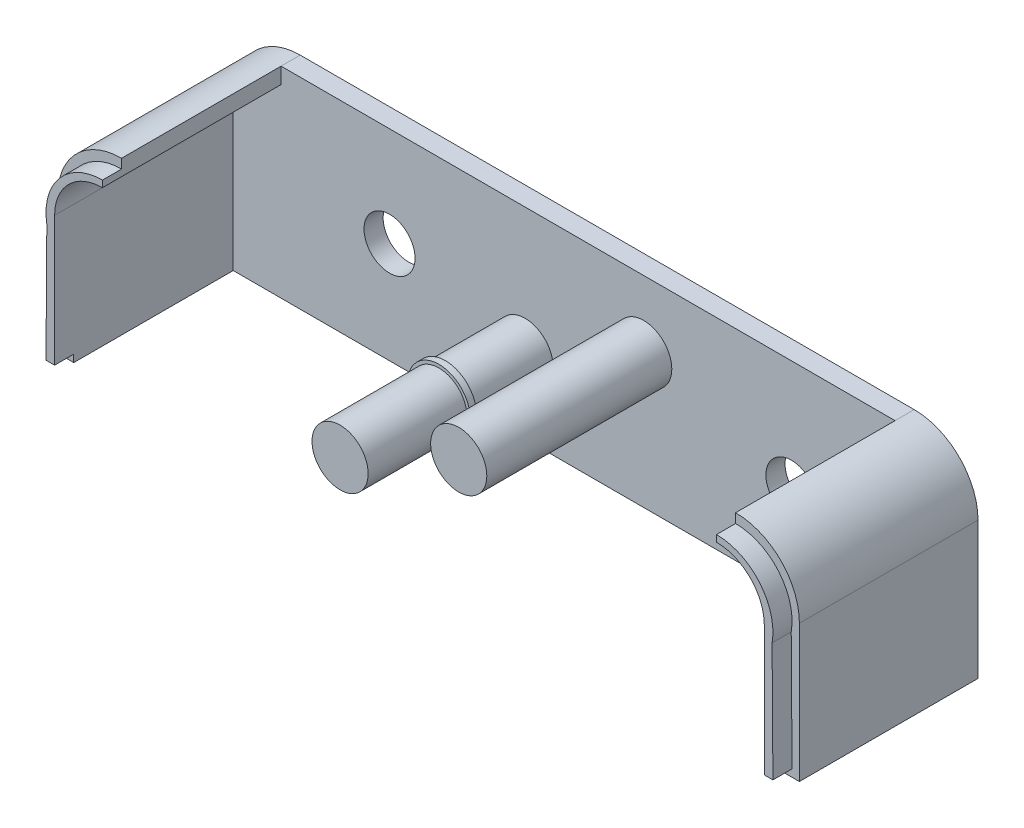
from build123d import *

# Parameters (mm, degrees)
SKETCH1_R           = 4
BOSS_EXTRUDE2_DEPTH = 3
SKETCH2_R           = 4.4
BOSS_EXTRUDE3_DEPTH = 25
CUT_EXTRUDE3_START  = -1
SKETCH10_R          = 4.4
CUT_EXTRUDE3_DEPTH  = 1
BOSS_EXTRUDE5_DEPTH = 3
SKETCH12_R          = 4.4
BOSS_EXTRUDE6_DEPTH = 5
SKETCH14_R          = 4.9
BOSS_EXTRUDE7_DEPTH = 1


with BuildPart() as part:
    # Sketch1 → Boss-Extrude2 (new body)
    with BuildSketch(Plane.XY):
        with BuildLine():
            Line((-48.125, 15.75), (48.125, 15.75))
            ThreePointArc((48.125, 15.75), (55.196067812, 12.821067812), (58.125, 5.75))
            Line((58.125, 5.75), (58.125, -15.75))
            Line((58.125, -15.75), (-58.125, -15.75))
            Line((-58.125, -15.75), (-58.125, 5.75))
            ThreePointArc((-58.125, 5.75), (-55.196067812, 12.821067812), (-48.125, 15.75))
        make_face()
        with Locations((31.875, -1.75)):
            Circle(SKETCH1_R, mode=Mode.SUBTRACT)
        with Locations((-31.125, 0.15)):
            Circle(SKETCH1_R, mode=Mode.SUBTRACT)
    extrude(amount=BOSS_EXTRUDE2_DEPTH)

    # Sketch2 → Boss-Extrude3 (add)
    with BuildSketch(Plane.XY.offset(3)):
        with Locations((8.725, 5.25)):
            Circle(SKETCH2_R)
        with Locations((-9.875, -3.75)):
            Circle(SKETCH2_R)
        with BuildLine():
            Line((55.625, 5.75), (55.625, -15.75))
            Line((55.625, -15.75), (58.125, -15.75))
            Line((58.125, -15.75), (58.125, 5.25))
            Line((58.125, 5.25), (58.125, 5.75))
            ThreePointArc((58.125, 5.75), (55.196067812, 12.821067812), (48.125, 15.75))
            Line((48.125, 15.75), (48.125, 13.25))
            ThreePointArc((48.125, 13.25), (53.428300859, 11.053300859), (55.625, 5.75))
        make_face()
        with BuildLine():
            Line((-58.125, -15.75), (-55.625, -15.75))
            Line((-55.625, -15.75), (-55.625, 5.75))
            ThreePointArc((-55.625, 5.75), (-53.428300859, 11.053300859), (-48.125, 13.25))
            Line((-48.125, 13.25), (-48.125, 15.75))
            ThreePointArc((-48.125, 15.75), (-55.196067812, 12.821067812), (-58.125, 5.75))
            Line((-58.125, 5.75), (-58.125, 5.25))
            Line((-58.125, 5.25), (-58.125, -15.75))
        make_face()
    extrude(amount=BOSS_EXTRUDE3_DEPTH)

    # Sketch10 → Cut-Extrude3 (cut)
    with BuildSketch(Plane.XY.offset(28).offset(CUT_EXTRUDE3_START)):
        with Locations((8.725, 5.25)):
            Circle(SKETCH10_R)
        with Locations((-9.875, -3.75)):
            Circle(SKETCH10_R)
    extrude(amount=CUT_EXTRUDE3_DEPTH, mode=Mode.SUBTRACT)

    # Sketch5 → Boss-Extrude5 (add)
    with BuildSketch(Plane.XY.offset(28)):
        with BuildLine():
            Line((-56.84687889, 3.934747007), (-56.975, -14.6))
            Line((-56.975, -14.6), (-55.625, -14.6))
            Line((-55.625, -14.6), (-55.625, 5.75))
            ThreePointArc((-55.625, 5.75), (-53.428300859, 11.053300859), (-48.125, 13.25))
            Line((-48.125, 13.25), (-48.125, 14.285189819))
            ThreePointArc((-48.125, 14.285189819), (-54.892622141, 11.137977782), (-56.84687889, 3.934747007))
        make_face()
        with BuildLine():
            Line((55.625, -14.6), (55.625, 5.75))
            ThreePointArc((55.625, 5.75), (53.428300859, 11.053300859), (48.125, 13.25))
            Line((48.125, 13.25), (48.125, 14.285189819))
            ThreePointArc((48.125, 14.285189819), (54.892622141, 11.137977782), (56.84687889, 3.934747007))
            Line((56.84687889, 3.934747007), (56.975, -14.6))
            Line((56.975, -14.6), (55.625, -14.6))
        make_face()
    extrude(amount=BOSS_EXTRUDE5_DEPTH)

    # Sketch12 → Boss-Extrude6 (add)
    with BuildSketch(Plane.XY.offset(27)):
        with Locations((-9.875, -3.75)):
            Circle(SKETCH12_R)
        with Locations((8.725, 5.25)):
            Circle(SKETCH12_R)
    extrude(amount=BOSS_EXTRUDE6_DEPTH)

    # Sketch14 → Boss-Extrude7 (add)
    with BuildSketch(Plane.XY.offset(15.5)):
        with Locations((-9.875, -3.75)):
            Circle(SKETCH14_R)
    extrude(amount=BOSS_EXTRUDE7_DEPTH)


solid = part.part
